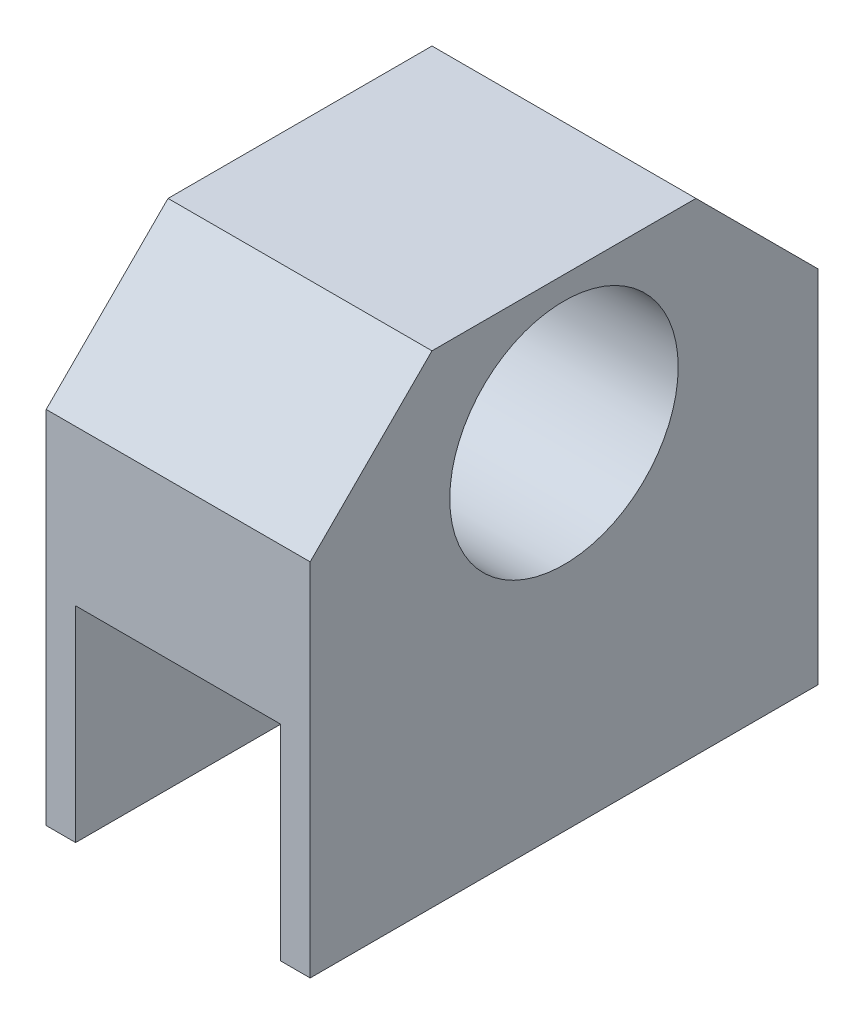
from build123d import *

# Parameters (mm, degrees)
SKETCH_1_R          = 11.25
EXTRUDE_1_DEPTH     = 13
SKETCH_2_W          = 20.2
SKETCH_2_H          = 20.2
CUT_EXTRUDE_1_DEPTH = 58.393379409


with BuildPart() as part:
    # Эскиз1 → Бобышка-Вытянуть1 (new, symmetric)
    with BuildSketch(Plane(origin=(0, 0, 0), x_dir=(0, 0, -1), z_dir=(1, 0, 0))):
        Polygon((-25, -25), (25, -25), (25, 10.5), (13, 22.5), (-13, 22.5), (-25, 10.5), align=None)
        with Locations(Location((0, 9, 0), (0, 0, 180))):
            Circle(SKETCH_1_R, mode=Mode.SUBTRACT)
    extrude(amount=EXTRUDE_1_DEPTH, both=True)

    # Эскиз2 → Вырез-Вытянуть1 (cut, through all)
    with BuildSketch(Plane(origin=(0, 0, -25), x_dir=(-1, 0, 0), z_dir=(0, 0, -1))):
        with Locations((0, -14.9)):
            Rectangle(SKETCH_2_W, SKETCH_2_H)
    extrude(amount=-CUT_EXTRUDE_1_DEPTH, mode=Mode.SUBTRACT)


solid = part.part
